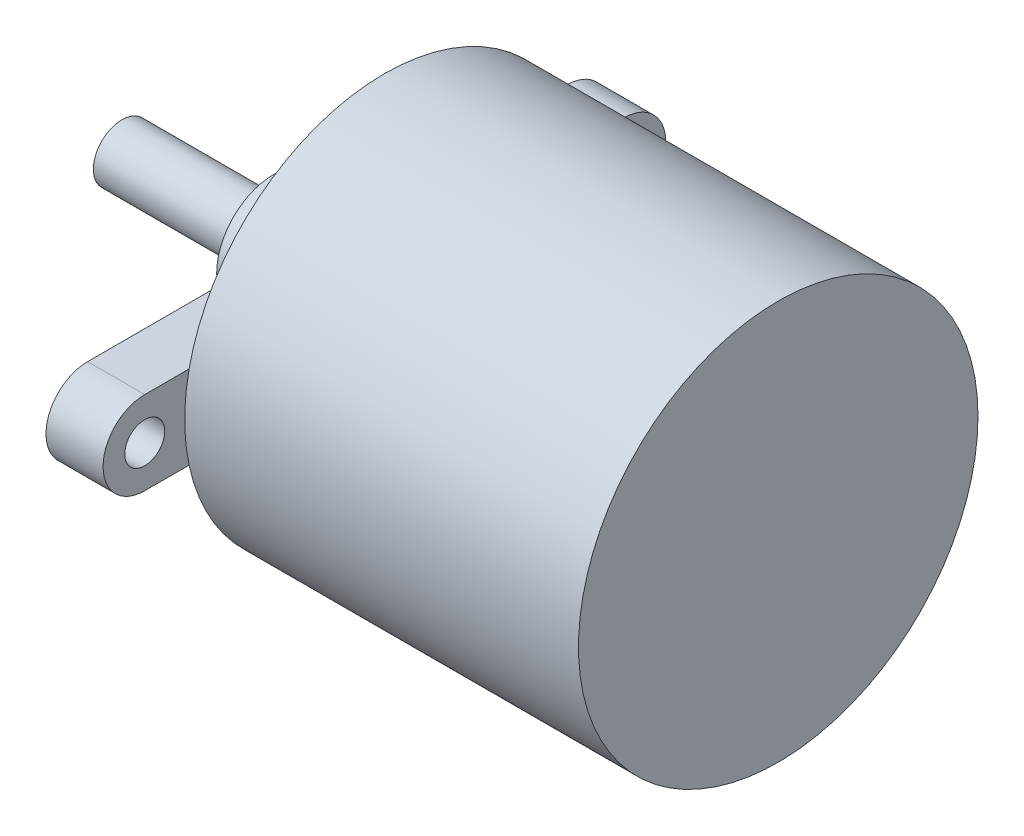
from build123d import *

# Parameters (mm, degrees)
SKETCH1_R                      = 17.5
BOSS_EXTRUDE1_DEPTH            = 34.5
BOSS_EXTRUDE2_DEPTH            = 5
F_3_5_3_5_DIAMETER_HOLE1_D     = 3.5
F_3_5_3_5_DIAMETER_HOLE1_DEPTH = 70
F_3_5_3_5_DIAMETER_HOLE1_TIP   = 1.051506083
SKETCH5_R                      = 5
BOSS_EXTRUDE3_DEPTH            = 4.7
SKETCH6_R                      = 2.5
BOSS_EXTRUDE4_DEPTH            = 13.3


with BuildPart() as part:
    # Sketch1 → Boss-Extrude1 (new body)
    with BuildSketch(Plane(origin=(0, 0, 0), x_dir=(0, 0, -1), z_dir=(1, 0, 0))):
        Circle(SKETCH1_R)
    extrude(amount=BOSS_EXTRUDE1_DEPTH)

    # Sketch2 → Boss-Extrude2 (add)
    with BuildSketch(Plane.ZY):
        with BuildLine():
            Line((-21, 3.65), (21, 3.65))
            ThreePointArc((21, 3.65), (24.65, 0), (21, -3.65))
            Line((21, -3.65), (-21, -3.65))
            ThreePointArc((-21, -3.65), (-24.65, 0), (-21, 3.65))
        make_face()
    extrude(amount=BOSS_EXTRUDE2_DEPTH)

    # Ø3.5 (3.5) Diameter Hole1
    with Locations(Plane.ZY.offset(5)):
        with Locations((-21, -0.140336266), (21, 0)):
            Hole(F_3_5_3_5_DIAMETER_HOLE1_D / 2, depth=F_3_5_3_5_DIAMETER_HOLE1_DEPTH)
            with Locations((0, 0, -(F_3_5_3_5_DIAMETER_HOLE1_DEPTH + F_3_5_3_5_DIAMETER_HOLE1_TIP / 2))):  # 118° drill point
                Cone(0, F_3_5_3_5_DIAMETER_HOLE1_D / 2, F_3_5_3_5_DIAMETER_HOLE1_TIP, mode=Mode.SUBTRACT)

    # Sketch5 → Boss-Extrude3 (add)
    with BuildSketch(Plane.ZY.offset(5)):
        with Locations(Location((0, 0, 0), (0, 0, 226.886394054))):
            Circle(SKETCH5_R)
    extrude(amount=BOSS_EXTRUDE3_DEPTH)

    # Sketch6 → Boss-Extrude4 (add)
    with BuildSketch(Plane.ZY.offset(9.7)):
        Circle(SKETCH6_R)
    extrude(amount=BOSS_EXTRUDE4_DEPTH)


solid = part.part
